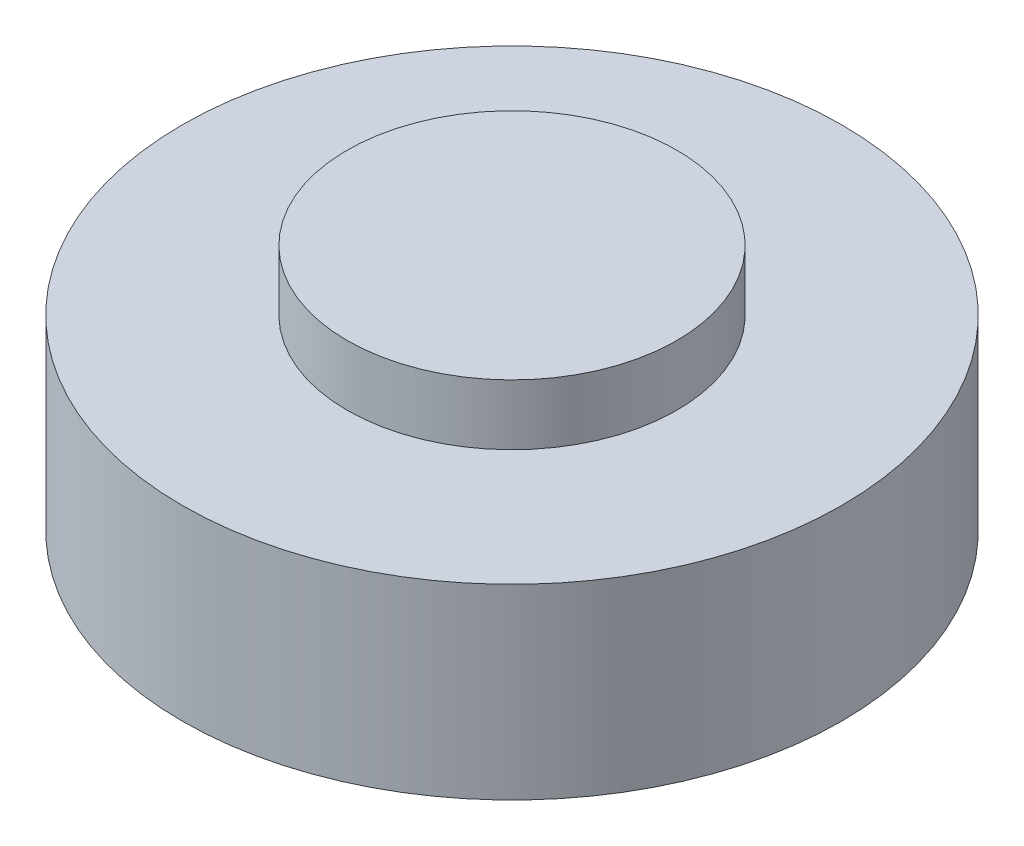
from build123d import *

# Parameters (mm, degrees)
CROQUIS1_R              = 30
SALIENTE_EXTRUIR1_DEPTH = 17
CROQUIS2_R              = 15
SALIENTE_EXTRUIR2_DEPTH = 5.5


with BuildPart() as part:
    # Croquis1 → Saliente-Extruir1 (new body)
    with BuildSketch(Plane(origin=(0, 0, 0), x_dir=(1, 0, 0), z_dir=(0, 1, 0))):
        with Locations(Location((0, 0, 0), (0, 0, 270))):
            Circle(CROQUIS1_R)
    extrude(amount=SALIENTE_EXTRUIR1_DEPTH)

    # Croquis2 → Saliente-Extruir2 (add)
    with BuildSketch(Plane(origin=(0, 17, 0), x_dir=(1, 0, 0), z_dir=(0, 1, 0))):
        with Locations(Location((0, 0, 0), (0, 0, 270))):
            Circle(CROQUIS2_R)
    extrude(amount=SALIENTE_EXTRUIR2_DEPTH)


solid = part.part
